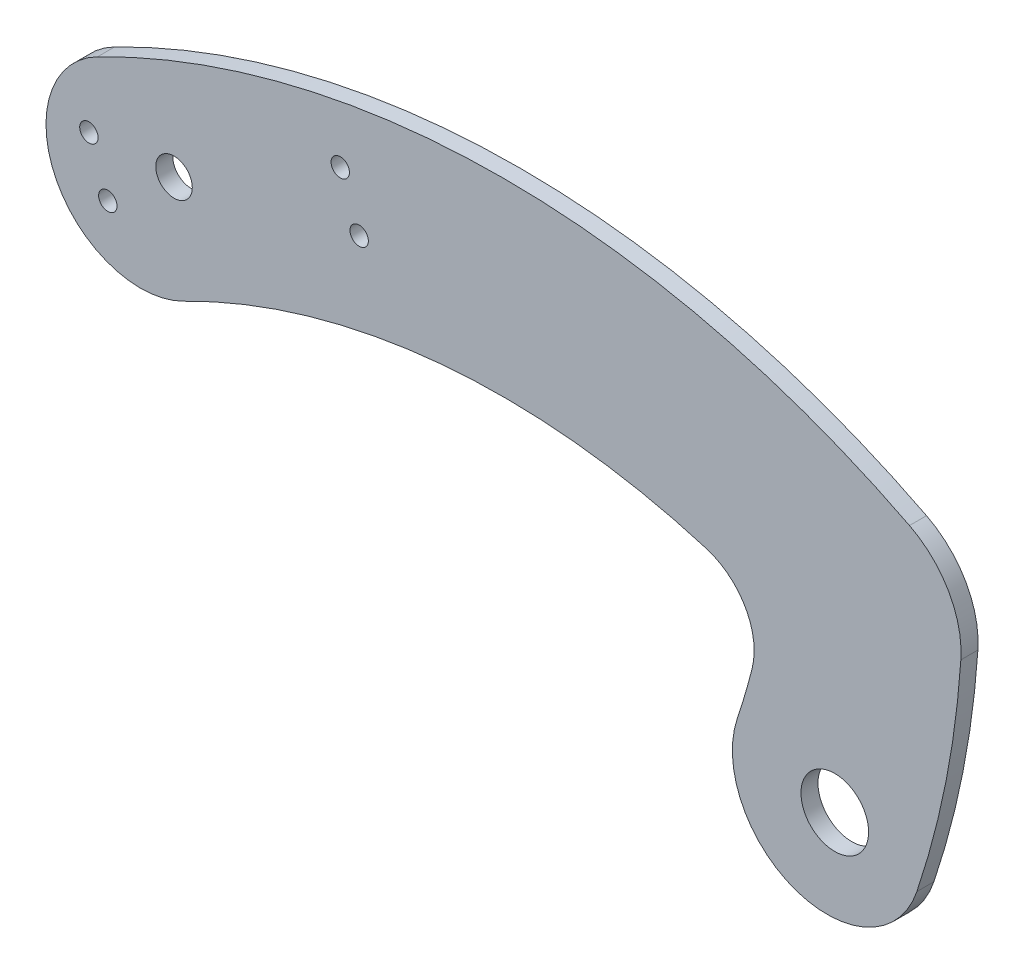
from build123d import *

# Parameters (mm, degrees)
BOSS_EXTRUDE1_DEPTH = 3.2004
SKETCH2_R           = 1.7272
SKETCH2_R_2         = 3.429
CUT_EXTRUDE1_DEPTH  = 3.2004
BOSS_EXTRUDE2_START = -3.2004
BOSS_EXTRUDE2_DEPTH = 3.2004
SKETCH4_R           = 6.35
CUT_EXTRUDE2_DEPTH  = 3.2004
FILLET1_R           = 12.7


with BuildPart() as part:
    # Sketch1 → Boss-Extrude1 (new body)
    with BuildSketch(Plane.XY):
        with BuildLine():
            ThreePointArc((-8.097097761, 15.832735205), (68.150612211, 34.198640293), (144.398322183, 15.832735205))
            ThreePointArc((144.398322183, 15.832735205), (152.133959628, -8.097097761), (128.204126662, -15.832735205))
            ThreePointArc((128.204126662, -15.832735205), (68.150612211, -1.367551307), (8.097097761, -15.832735205))
            ThreePointArc((8.097097761, -15.832735205), (-15.832735205, -8.097097761), (-8.097097761, 15.832735205))
        make_face()
    extrude(amount=BOSS_EXTRUDE1_DEPTH)

    # Sketch2 → Cut-Extrude1 (cut)
    with BuildSketch(Plane.XY.offset(3.2004)):
        with Locations((41.033365074, 11.300266799)):
            Circle(SKETCH2_R)
        with Locations((-9.725802761, 2.712083558)):
            Circle(SKETCH2_R)
        with Locations((-6.174081457, -6.6359257)):
            Circle(SKETCH2_R)
        with Locations((37.48164377, 20.648276058)):
            Circle(SKETCH2_R)
        with Locations((6.261836343, 3.437760818)):
            Circle(SKETCH2_R_2)
    extrude(amount=-CUT_EXTRUDE1_DEPTH, mode=Mode.SUBTRACT)

    # Sketch3 → Boss-Extrude2 (add)
    with BuildSketch(Plane.XY.offset(3.2004).offset(BOSS_EXTRUDE2_START)):
        with BuildLine():
            ThreePointArc((118.558560015, 1.198480685), (137.499705108, 17.742664408), (154.04388883, -1.198480685))
            ThreePointArc((154.04388883, -1.198480685), (151.248704167, -22.371604894), (145.781416871, -43.0167742))
            ThreePointArc((145.781416871, -43.0167742), (123.276823543, -54.242649292), (112.05094845, -31.738055964))
            ThreePointArc((112.05094845, -31.738055964), (116.357042584, -15.477699112), (118.558560015, 1.198480685))
        make_face()
    extrude(amount=BOSS_EXTRUDE2_DEPTH)

    # Sketch4 → Cut-Extrude2 (cut)
    with BuildSketch(Plane.XY.offset(3.2004)):
        with Locations((130.361522506, -37.860704571)):
            Circle(SKETCH4_R)
    extrude(amount=-CUT_EXTRUDE2_DEPTH, mode=Mode.SUBTRACT)

    # Fillet1
    fillet1_edges = [part.edges().sort_by_distance(p)[0] for p in [
        (117.190242121, -10.823434725, 1.6002),
    ]]
    fillet(fillet1_edges, radius=FILLET1_R)


solid = part.part
